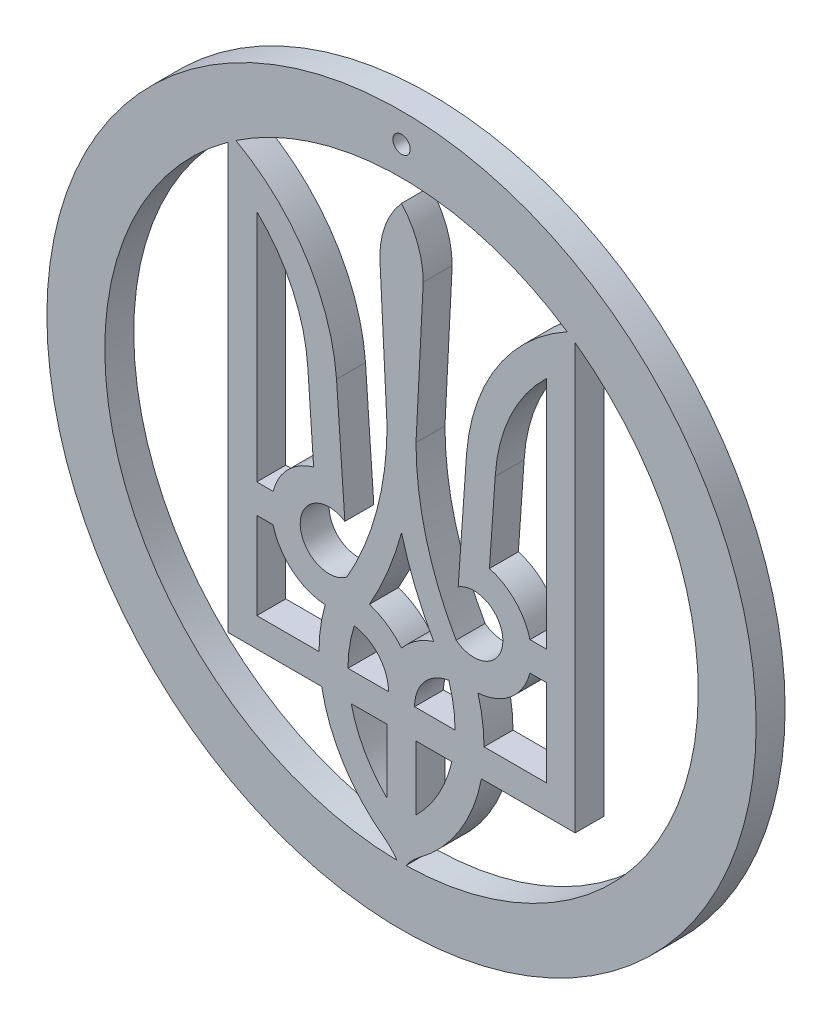
from build123d import *

# Parameters (mm, degrees)
EXTRUDE_1_DEPTH = 10
SKETCH_3_R      = 122.5
SKETCH_3_R_2    = 102.5
SKETCH_3_R_3    = 3
EXTRUDE_2_DEPTH = 10


with BuildPart() as part:
    # Эскиз1 → Бобышка-Вытянуть1 (new body)
    with BuildSketch(Plane.XY):
        with BuildLine():
            Line((-60, -45), (-27.583269132, -45))
            ThreePointArc((-27.583269132, -45), (-20.06001769, -64.277376125), (-5.945767968, -79.41027067))
            ThreePointArc((-5.945767968, -79.41027067), (-2.542345747, -82.680315027), (0, -86.656865167))
            Line((0, -86.656865167), (0, -19.711115149))
            ThreePointArc((0, -19.711115149), (-5.008387109, -15.151161707), (-11.091351129, -12.172124017))
            ThreePointArc((-11.091351129, -12.172124017), (-4.677676581, 0.965070873), (0, 14.815718966))
            Line((0, 14.815718966), (0, 113.343134833))
            ThreePointArc((0, 113.343134833), (-5.562430401, 104.106601718), (-7.5, 93.5))
            Line((-7.5, 93.5), (-5, 44.25))
            ThreePointArc((-5, 44.25), (-8.525159088, 17.271181236), (-18.863936417, -7.896120801))
            ThreePointArc((-18.863936417, -7.896120801), (-34.990467135, -0.436539144), (-19.576058944, 8.401241779))
            Line((-19.576058944, 8.401241779), (-22.449472465, 49.49296956))
            ThreePointArc((-22.449472465, 49.49296956), (-33.881518529, 82.214174393), (-60, 105))
            Line((-60, 105), (-60, -45))
        make_face()
        with BuildLine():
            ThreePointArc((-26.401072965, -19.950864506), (-27.972740949, -27.40259956), (-28.5, -35))
            Line((-28.5, -35), (-50, -35))
            Line((-50, -35), (-50, -5))
            Line((-50, -5), (-44.364916731, -5))
            ThreePointArc((-44.364916731, -5), (-37.794087282, -15.372421104), (-26.401072965, -19.950864506))
        make_face(mode=Mode.SUBTRACT)
        with BuildLine():
            Line((-5, -45), (-5, -67.136427928))
            ThreePointArc((-5, -67.136427928), (-12.779082294, -56.957998409), (-17.374821937, -45))
            Line((-17.374821937, -45), (-5, -45))
        make_face(mode=Mode.SUBTRACT)
        with BuildLine():
            Line((-4.5, -35), (-18.5, -35))
            ThreePointArc((-18.5, -35), (-17.952221542, -28), (-16.322222222, -21.170419965))
            ThreePointArc((-16.322222222, -21.170419965), (-7.858362699, -25.902991945), (-4.5, -35))
        make_face(mode=Mode.SUBTRACT)
        with BuildLine():
            Line((-44.364916731, 5), (-50, 5))
            Line((-50, 5), (-50, 85.909197079))
            ThreePointArc((-50, 85.909197079), (-37.591425702, 68.515820434), (-32.355603325, 47.801370616))
            Line((-32.355603325, 47.801370616), (-30.360374841, 19.268273964))
            ThreePointArc((-30.360374841, 19.268273964), (-39.273434111, 14.009606657), (-44.364916731, 5))
        make_face(mode=Mode.SUBTRACT)
    extrude_1 = extrude(amount=EXTRUDE_1_DEPTH)

    # Зеркальное отражение1: Бобышка-Вытянуть1 across plane
    add(extrude_1.mirror(Plane(origin=(0, 0, 0), x_dir=(0, 0, 1), z_dir=(1, 0, 0))))

    # Эскиз3 → Бобышка-Вытянуть2 (add)
    with BuildSketch(Plane.XY):
        with Locations((0, 18.5)):
            Circle(SKETCH_3_R)
        with Locations((0, 18.5)):
            Circle(SKETCH_3_R_2, mode=Mode.SUBTRACT)
        with Locations((0, 131)):
            Circle(SKETCH_3_R_3, mode=Mode.SUBTRACT)
    extrude(amount=EXTRUDE_2_DEPTH)


solid = part.part
